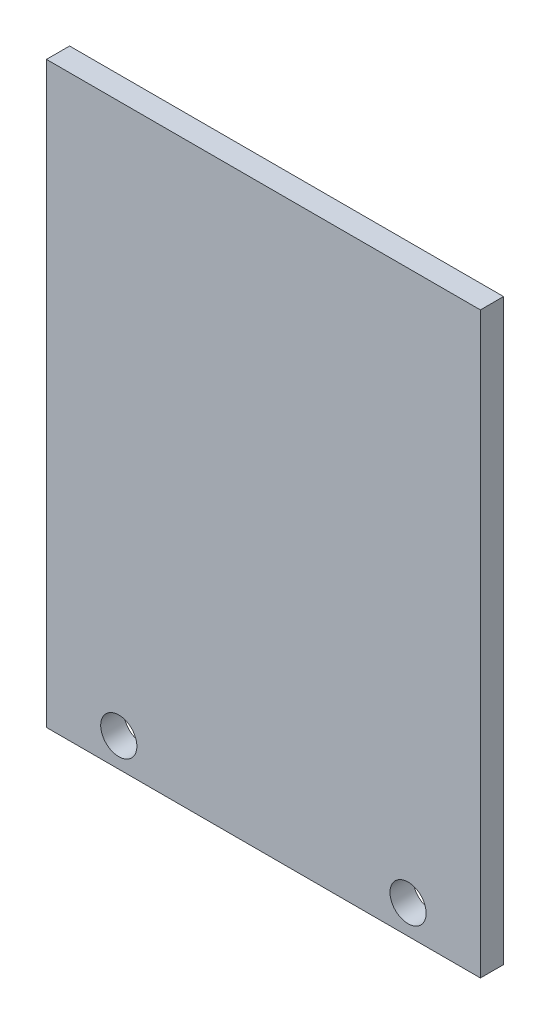
from build123d import *

# Parameters (mm, degrees)
SKETCH1_W           = 30
SKETCH1_H           = 40
SKETCH1_R           = 1.25
BOSS_EXTRUDE1_DEPTH = 1.6


with BuildPart() as part:
    # Sketch1 → Boss-Extrude1 (new body)
    with BuildSketch(Plane.XY):
        Rectangle(SKETCH1_W, SKETCH1_H)
        with Locations((-10, -18)):
            Circle(SKETCH1_R, mode=Mode.SUBTRACT)
        with Locations((10, -18)):
            Circle(SKETCH1_R, mode=Mode.SUBTRACT)
    extrude(amount=BOSS_EXTRUDE1_DEPTH)


solid = part.part
